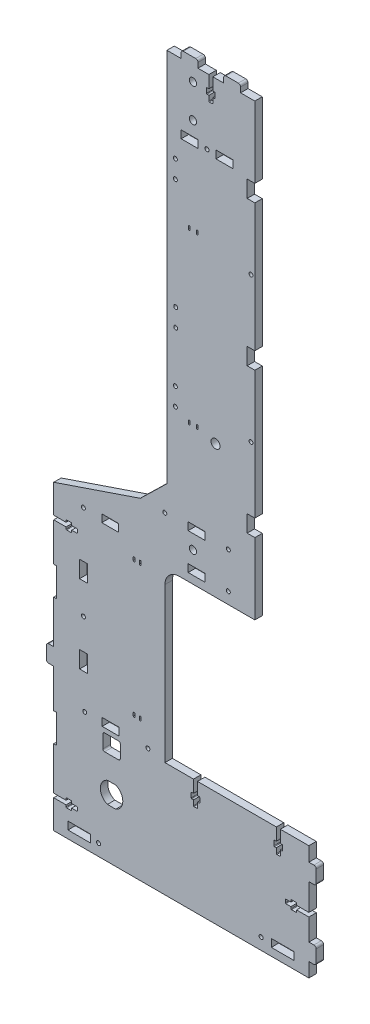
from build123d import *

# Parameters (mm, degrees)
MODEL_R             = 1.775
MODEL_R_2           = 3.25
MODEL_R_3           = 4
MODEL_W             = 15
MODEL_H             = 6.88
MODEL_W_2           = 20
MODEL_H_2           = 6.86
MODEL_W_3           = 6.88
MODEL_H_3           = 15
BOSS_EXTRUDE1_DEPTH = 6.6


with BuildPart() as part:
    # Model → Boss-Extrude1 (new body)
    with BuildSketch(Plane.XY):
        with BuildLine():
            Line((48.1, -177.69), (52.6, -177.69))
            ThreePointArc((52.6, -177.69), (54.014213562, -177.104213562), (54.6, -175.69))
            Line((54.6, -175.69), (54.6, -164.69))
            ThreePointArc((54.6, -164.69), (54.014213562, -163.275786438), (52.6, -162.69))
            Line((52.6, -162.69), (48.1, -162.69))
            Line((48.1, -162.69), (48.1, -149.99))
            Line((48.1, -149.99), (22.7, -149.99))
            Line((22.7, -149.99), (22.7, -160.99))
            Line((22.7, -160.99), (24.285, -160.99))
            ThreePointArc((24.285, -160.99), (24.638553391, -161.136446609), (24.785, -161.49))
            Line((24.785, -161.49), (24.785, -165.49))
            ThreePointArc((24.785, -165.49), (24.638553391, -165.843553391), (24.285, -165.99))
            Line((24.285, -165.99), (22.7, -165.99))
            Line((22.7, -165.99), (22.7, -170.49))
            ThreePointArc((22.7, -170.49), (22.553553391, -170.843553391), (22.2, -170.99))
            Line((22.2, -170.99), (19.65, -170.99))
            ThreePointArc((19.65, -170.99), (19.296446609, -170.843553391), (19.15, -170.49))
            Line((19.15, -170.49), (19.15, -165.99))
            Line((19.15, -165.99), (17.565, -165.99))
            ThreePointArc((17.565, -165.99), (17.211446609, -165.843553391), (17.065, -165.49))
            Line((17.065, -165.49), (17.065, -161.49))
            ThreePointArc((17.065, -161.49), (17.211446609, -161.136446609), (17.565, -160.99))
            Line((17.565, -160.99), (19.15, -160.99))
            Line((19.15, -160.99), (19.15, -149.99))
            Line((19.15, -149.99), (-51.05, -149.99))
            Line((-51.05, -149.99), (-51.05, -160.99))
            Line((-51.05, -160.99), (-49.465, -160.99))
            ThreePointArc((-49.465, -160.99), (-49.111446609, -161.136446609), (-48.965, -161.49))
            Line((-48.965, -161.49), (-48.965, -165.49))
            ThreePointArc((-48.965, -165.49), (-49.111446609, -165.843553391), (-49.465, -165.99))
            Line((-49.465, -165.99), (-51.05, -165.99))
            Line((-51.05, -165.99), (-51.05, -170.49))
            ThreePointArc((-51.05, -170.49), (-51.196446609, -170.843553391), (-51.55, -170.99))
            Line((-51.55, -170.99), (-54.1, -170.99))
            ThreePointArc((-54.1, -170.99), (-54.453553391, -170.843553391), (-54.6, -170.49))
            Line((-54.6, -170.49), (-54.6, -165.99))
            Line((-54.6, -165.99), (-56.185, -165.99))
            ThreePointArc((-56.185, -165.99), (-56.538553391, -165.843553391), (-56.685, -165.49))
            Line((-56.685, -165.49), (-56.685, -161.49))
            ThreePointArc((-56.685, -161.49), (-56.538553391, -161.136446609), (-56.185, -160.99))
            Line((-56.185, -160.99), (-54.6, -160.99))
            Line((-54.6, -160.99), (-54.6, -149.99))
            Line((-54.6, -149.99), (-80, -149.99))
            Line((-80, -149.99), (-80, -12.7))
            ThreePointArc((-80, -12.7), (-76.280256121, -3.719743879), (-67.3, 0))
            Line((-67.3, 0), (0, 0))
            Line((0, 0), (0, 63.5))
            Line((0, 63.5), (-6.86, 63.5))
            Line((-6.86, 63.5), (-6.86, 78.5))
            Line((-6.86, 78.5), (0, 78.5))
            Line((0, 78.5), (0, 192.525))
            Line((0, 192.525), (-6.86, 192.525))
            Line((-6.86, 192.525), (-6.86, 207.525))
            Line((-6.86, 207.525), (0, 207.525))
            Line((0, 207.525), (0, 321.55))
            Line((0, 321.55), (-6.86, 321.55))
            Line((-6.86, 321.55), (-6.86, 336.55))
            Line((-6.86, 336.55), (0, 336.55))
            Line((0, 336.55), (0, 400.05))
            Line((0, 400.05), (-12.7, 400.05))
            Line((-12.7, 400.05), (-12.7, 404.55))
            ThreePointArc((-12.7, 404.55), (-13.285786438, 405.964213562), (-14.7, 406.55))
            Line((-14.7, 406.55), (-25.7, 406.55))
            ThreePointArc((-25.7, 406.55), (-27.114213562, 405.964213562), (-27.7, 404.55))
            Line((-27.7, 404.55), (-27.7, 400.05))
            Line((-27.7, 400.05), (-37.375, 400.05))
            Line((-37.375, 400.05), (-37.375, 389.05))
            Line((-37.375, 389.05), (-35.79, 389.05))
            ThreePointArc((-35.79, 389.05), (-35.436446609, 388.903553391), (-35.29, 388.55))
            Line((-35.29, 388.55), (-35.29, 384.55))
            ThreePointArc((-35.29, 384.55), (-35.436446609, 384.196446609), (-35.79, 384.05))
            Line((-35.79, 384.05), (-37.375, 384.05))
            Line((-37.375, 384.05), (-37.375, 379.55))
            ThreePointArc((-37.375, 379.55), (-37.521446609, 379.196446609), (-37.875, 379.05))
            Line((-37.875, 379.05), (-40.425, 379.05))
            ThreePointArc((-40.425, 379.05), (-40.778553391, 379.196446609), (-40.925, 379.55))
            Line((-40.925, 379.55), (-40.925, 384.05))
            Line((-40.925, 384.05), (-42.51, 384.05))
            ThreePointArc((-42.51, 384.05), (-42.863553391, 384.196446609), (-43.01, 384.55))
            Line((-43.01, 384.55), (-43.01, 388.55))
            ThreePointArc((-43.01, 388.55), (-42.863553391, 388.903553391), (-42.51, 389.05))
            Line((-42.51, 389.05), (-40.925, 389.05))
            Line((-40.925, 389.05), (-40.925, 400.05))
            Line((-40.925, 400.05), (-50.6, 400.05))
            Line((-50.6, 400.05), (-50.6, 404.55))
            ThreePointArc((-50.6, 404.55), (-51.185786438, 405.964213562), (-52.6, 406.55))
            Line((-52.6, 406.55), (-63.6, 406.55))
            ThreePointArc((-63.6, 406.55), (-65.014213562, 405.964213562), (-65.6, 404.55))
            Line((-65.6, 404.55), (-65.6, 400.05))
            Line((-65.6, 400.05), (-78.3, 400.05))
            Line((-78.3, 400.05), (-78.3, 65.85))
            Line((-78.3, 65.85), (-101.973254423, 42.814016861))
            Line((-101.973254423, 42.814016861), (-179.05, 16.65))
            Line((-179.05, 16.65), (-179.05, -8.75))
            Line((-179.05, -8.75), (-168.05, -8.75))
            Line((-168.05, -8.75), (-168.05, -7.165))
            ThreePointArc((-168.05, -7.165), (-167.903553391, -6.811446609), (-167.55, -6.665))
            Line((-167.55, -6.665), (-163.55, -6.665))
            ThreePointArc((-163.55, -6.665), (-163.196446609, -6.811446609), (-163.05, -7.165))
            Line((-163.05, -7.165), (-163.05, -8.75))
            Line((-163.05, -8.75), (-158.55, -8.75))
            ThreePointArc((-158.55, -8.75), (-158.196446609, -8.896446609), (-158.05, -9.25))
            Line((-158.05, -9.25), (-158.05, -11.8))
            ThreePointArc((-158.05, -11.8), (-158.196446609, -12.153553391), (-158.55, -12.3))
            Line((-158.55, -12.3), (-163.05, -12.3))
            Line((-163.05, -12.3), (-163.05, -13.885))
            ThreePointArc((-163.05, -13.885), (-163.196446609, -14.238553391), (-163.55, -14.385))
            Line((-163.55, -14.385), (-167.55, -14.385))
            ThreePointArc((-167.55, -14.385), (-167.903553391, -14.238553391), (-168.05, -13.885))
            Line((-168.05, -13.885), (-168.05, -12.3))
            Line((-168.05, -12.3), (-179.05, -12.3))
            Line((-179.05, -12.3), (-179.05, -46.53))
            Line((-179.05, -46.53), (-176.35, -46.53))
            Line((-176.35, -46.53), (-176.35, -71.93))
            Line((-176.35, -71.93), (-179.05, -71.93))
            Line((-179.05, -71.93), (-179.05, -110.17))
            Line((-179.05, -110.17), (-183.55, -110.17))
            ThreePointArc((-183.55, -110.17), (-184.964213562, -110.755786438), (-185.55, -112.17))
            Line((-185.55, -112.17), (-185.55, -123.17))
            ThreePointArc((-185.55, -123.17), (-184.964213562, -124.584213562), (-183.55, -125.17))
            Line((-183.55, -125.17), (-179.05, -125.17))
            Line((-179.05, -125.17), (-179.05, -159.53))
            Line((-179.05, -159.53), (-176.35, -159.53))
            Line((-176.35, -159.53), (-176.35, -184.93))
            Line((-176.35, -184.93), (-179.05, -184.93))
            Line((-179.05, -184.93), (-179.05, -223.04))
            Line((-179.05, -223.04), (-168.05, -223.04))
            Line((-168.05, -223.04), (-168.05, -221.455))
            ThreePointArc((-168.05, -221.455), (-167.903553391, -221.101446609), (-167.55, -220.955))
            Line((-167.55, -220.955), (-163.55, -220.955))
            ThreePointArc((-163.55, -220.955), (-163.196446609, -221.101446609), (-163.05, -221.455))
            Line((-163.05, -221.455), (-163.05, -223.04))
            Line((-163.05, -223.04), (-158.55, -223.04))
            ThreePointArc((-158.55, -223.04), (-158.196446609, -223.186446609), (-158.05, -223.54))
            Line((-158.05, -223.54), (-158.05, -226.09))
            ThreePointArc((-158.05, -226.09), (-158.196446609, -226.443553391), (-158.55, -226.59))
            Line((-158.55, -226.59), (-163.05, -226.59))
            Line((-163.05, -226.59), (-163.05, -228.175))
            ThreePointArc((-163.05, -228.175), (-163.196446609, -228.528553391), (-163.55, -228.675))
            Line((-163.55, -228.675), (-167.55, -228.675))
            ThreePointArc((-167.55, -228.675), (-167.903553391, -228.528553391), (-168.05, -228.175))
            Line((-168.05, -228.175), (-168.05, -226.59))
            Line((-168.05, -226.59), (-179.05, -226.59))
            Line((-179.05, -226.59), (-179.05, -251.99))
            Line((-179.05, -251.99), (48.1, -251.99))
            Line((48.1, -251.99), (48.1, -239.29))
            Line((48.1, -239.29), (52.6, -239.29))
            ThreePointArc((52.6, -239.29), (54.014213562, -238.704213562), (54.6, -237.29))
            Line((54.6, -237.29), (54.6, -226.29))
            ThreePointArc((54.6, -226.29), (54.014213562, -224.875786438), (52.6, -224.29))
            Line((52.6, -224.29), (48.1, -224.29))
            Line((48.1, -224.29), (48.1, -204.99))
            Line((48.1, -204.99), (37.1, -204.99))
            Line((37.1, -204.99), (37.1, -206.575))
            ThreePointArc((37.1, -206.575), (36.953553391, -206.928553391), (36.6, -207.075))
            Line((36.6, -207.075), (32.6, -207.075))
            ThreePointArc((32.6, -207.075), (32.246446609, -206.928553391), (32.1, -206.575))
            Line((32.1, -206.575), (32.1, -204.99))
            Line((32.1, -204.99), (27.6, -204.99))
            ThreePointArc((27.6, -204.99), (27.246446609, -204.843553391), (27.1, -204.49))
            Line((27.1, -204.49), (27.1, -201.94))
            ThreePointArc((27.1, -201.94), (27.246446609, -201.586446609), (27.6, -201.44))
            Line((27.6, -201.44), (32.1, -201.44))
            Line((32.1, -201.44), (32.1, -199.855))
            ThreePointArc((32.1, -199.855), (32.246446609, -199.501446609), (32.6, -199.355))
            Line((32.6, -199.355), (36.6, -199.355))
            ThreePointArc((36.6, -199.355), (36.953553391, -199.501446609), (37.1, -199.855))
            Line((37.1, -199.855), (37.1, -201.44))
            Line((37.1, -201.44), (48.1, -201.44))
            Line((48.1, -201.44), (48.1, -177.69))
        make_face()
        with Locations((-42.59, 341.61)):
            Circle(MODEL_R, mode=Mode.SUBTRACT)
        with Locations((-151.415, -146.56)):
            Circle(MODEL_R, mode=Mode.SUBTRACT)
        with Locations((5.575, -241.67)):
            Circle(MODEL_R, mode=Mode.SUBTRACT)
        with Locations((-139.175, -241.67)):
            Circle(MODEL_R, mode=Mode.SUBTRACT)
        with Locations((-95.225, -146.56)):
            Circle(MODEL_R, mode=Mode.SUBTRACT)
        with Locations((-80.155, 42.57)):
            Circle(MODEL_R, mode=Mode.SUBTRACT)
        with Locations((-23.605, 42.57)):
            Circle(MODEL_R, mode=Mode.SUBTRACT)
        with Locations((-23.605, 10.31)):
            Circle(MODEL_R, mode=Mode.SUBTRACT)
        with Locations((-3.43, 135.5125)):
            Circle(MODEL_R, mode=Mode.SUBTRACT)
        with Locations((-3.43, 264.5375)):
            Circle(MODEL_R, mode=Mode.SUBTRACT)
        with Locations((-152.61, 10.31)):
            Circle(MODEL_R, mode=Mode.SUBTRACT)
        with Locations((-152.61, -73.52)):
            Circle(MODEL_R, mode=Mode.SUBTRACT)
        with Locations((-55.125192642, 26.44)):
            Circle(MODEL_R_2, mode=Mode.SUBTRACT)
        with Locations((-55.125192623, 357.75)):
            Circle(MODEL_R_2, mode=Mode.SUBTRACT)
        with Locations((-55.125192623, 387.35)):
            Circle(MODEL_R_2, mode=Mode.SUBTRACT)
        with Locations((-70.7591875, 129.0125)):
            Circle(MODEL_R, mode=Mode.SUBTRACT)
        with Locations((-70.7591875, 144.8875)):
            Circle(MODEL_R, mode=Mode.SUBTRACT)
        with Locations((-70.7591875, 304.4125)):
            Circle(MODEL_R, mode=Mode.SUBTRACT)
        with Locations((-70.7591875, 320.2875)):
            Circle(MODEL_R, mode=Mode.SUBTRACT)
        with Locations((-34.98813147, 118.374662343)):
            Circle(MODEL_R_3, mode=Mode.SUBTRACT)
        with Locations((-70.41, 205.9875)):
            Circle(MODEL_R, mode=Mode.SUBTRACT)
        with Locations((-70.41, 190.1125)):
            Circle(MODEL_R, mode=Mode.SUBTRACT)
        with Locations((-27.08, 341.61)):
            Rectangle(MODEL_W, MODEL_H, mode=Mode.SUBTRACT)
        with Locations((24.65, -241.67)):
            Rectangle(MODEL_W_2, MODEL_H, mode=Mode.SUBTRACT)
        with Locations((-156.35, -241.67)):
            Rectangle(MODEL_W_2, MODEL_H, mode=Mode.SUBTRACT)
        with Locations((-128.75, 10.31)):
            Rectangle(MODEL_W, MODEL_H_2, mode=Mode.SUBTRACT)
        with Locations((-58.1, 341.61)):
            Rectangle(MODEL_W, MODEL_H, mode=Mode.SUBTRACT)
        with Locations((-51.88, 10.31)):
            Rectangle(MODEL_W, MODEL_H_2, mode=Mode.SUBTRACT)
        with Locations((-51.88, 42.57)):
            Rectangle(MODEL_W, MODEL_H_2, mode=Mode.SUBTRACT)
        with Locations((-128.4, -146.56)):
            Rectangle(MODEL_W, MODEL_H_2, mode=Mode.SUBTRACT)
        with Locations((-152.61, -38.72)):
            Rectangle(MODEL_W_3, MODEL_H_3, mode=Mode.SUBTRACT)
        with Locations((-152.61, -108.32)):
            Rectangle(MODEL_W_3, MODEL_H_3, mode=Mode.SUBTRACT)
        with BuildLine():
            Line((-135.29, -155.45875), (-135.29, -167.00875))
            ThreePointArc((-135.29, -167.00875), (-134.850660172, -168.069410172), (-133.79, -168.50875))
            Line((-133.79, -168.50875), (-121.31, -168.50875))
            ThreePointArc((-121.31, -168.50875), (-120.249339828, -168.069410172), (-119.81, -167.00875))
            Line((-119.81, -167.00875), (-119.81, -155.45875))
            ThreePointArc((-119.81, -155.45875), (-120.249339828, -154.398089828), (-121.31, -153.95875))
            Line((-121.31, -153.95875), (-133.79, -153.95875))
            ThreePointArc((-133.79, -153.95875), (-134.850660172, -154.398089828), (-135.29, -155.45875))
        make_face(mode=Mode.SUBTRACT)
        with BuildLine():
            Line((-123.87440481, -189.20875), (-131.22559519, -189.20875))
            ThreePointArc((-131.22559519, -189.20875), (-137.55, -198.50875), (-131.22559519, -207.80875))
            Line((-131.22559519, -207.80875), (-123.87440481, -207.80875))
            ThreePointArc((-123.87440481, -207.80875), (-117.55, -198.50875), (-123.87440481, -189.20875))
        make_face(mode=Mode.SUBTRACT)
        with BuildLine():
            Line((-57.55, 271.85), (-57.55, 274.25))
            ThreePointArc((-57.55, 274.25), (-58.3, 275), (-59.05, 274.25))
            Line((-59.05, 274.25), (-59.05, 271.85))
            ThreePointArc((-59.05, 271.85), (-58.3, 271.1), (-57.55, 271.85))
        make_face(mode=Mode.SUBTRACT)
        with BuildLine():
            Line((-50.55, 271.85), (-50.55, 274.25))
            ThreePointArc((-50.55, 274.25), (-51.3, 275), (-52.05, 274.25))
            Line((-52.05, 274.25), (-52.05, 271.85))
            ThreePointArc((-52.05, 271.85), (-51.3, 271.1), (-50.55, 271.85))
        make_face(mode=Mode.SUBTRACT)
        with BuildLine():
            Line((-57.55, 121.85), (-57.55, 124.25))
            ThreePointArc((-57.55, 124.25), (-58.3, 125), (-59.05, 124.25))
            Line((-59.05, 124.25), (-59.05, 121.85))
            ThreePointArc((-59.05, 121.85), (-58.3, 121.1), (-57.55, 121.85))
        make_face(mode=Mode.SUBTRACT)
        with BuildLine():
            Line((-50.55, 121.85), (-50.55, 124.25))
            ThreePointArc((-50.55, 124.25), (-51.3, 125), (-52.05, 124.25))
            Line((-52.05, 124.25), (-52.05, 121.85))
            ThreePointArc((-52.05, 121.85), (-51.3, 121.1), (-50.55, 121.85))
        make_face(mode=Mode.SUBTRACT)
        with BuildLine():
            Line((-106.75, -128.13), (-106.75, -125.73))
            ThreePointArc((-106.75, -125.73), (-107.5, -124.98), (-108.25, -125.73))
            Line((-108.25, -125.73), (-108.25, -128.13))
            ThreePointArc((-108.25, -128.13), (-107.5, -128.88), (-106.75, -128.13))
        make_face(mode=Mode.SUBTRACT)
        with BuildLine():
            Line((-101.25, -128.13), (-101.25, -125.73))
            ThreePointArc((-101.25, -125.73), (-102, -124.98), (-102.75, -125.73))
            Line((-102.75, -125.73), (-102.75, -128.13))
            ThreePointArc((-102.75, -128.13), (-102, -128.88), (-101.25, -128.13))
        make_face(mode=Mode.SUBTRACT)
        with BuildLine():
            Line((-106.75, -8.13), (-106.75, -5.73))
            ThreePointArc((-106.75, -5.73), (-107.5, -4.98), (-108.25, -5.73))
            Line((-108.25, -5.73), (-108.25, -8.13))
            ThreePointArc((-108.25, -8.13), (-107.5, -8.88), (-106.75, -8.13))
        make_face(mode=Mode.SUBTRACT)
        with BuildLine():
            Line((-101.25, -8.13), (-101.25, -5.73))
            ThreePointArc((-101.25, -5.73), (-102, -4.98), (-102.75, -5.73))
            Line((-102.75, -5.73), (-102.75, -8.13))
            ThreePointArc((-102.75, -8.13), (-102, -8.88), (-101.25, -8.13))
        make_face(mode=Mode.SUBTRACT)
    extrude(amount=BOSS_EXTRUDE1_DEPTH)


solid = part.part
